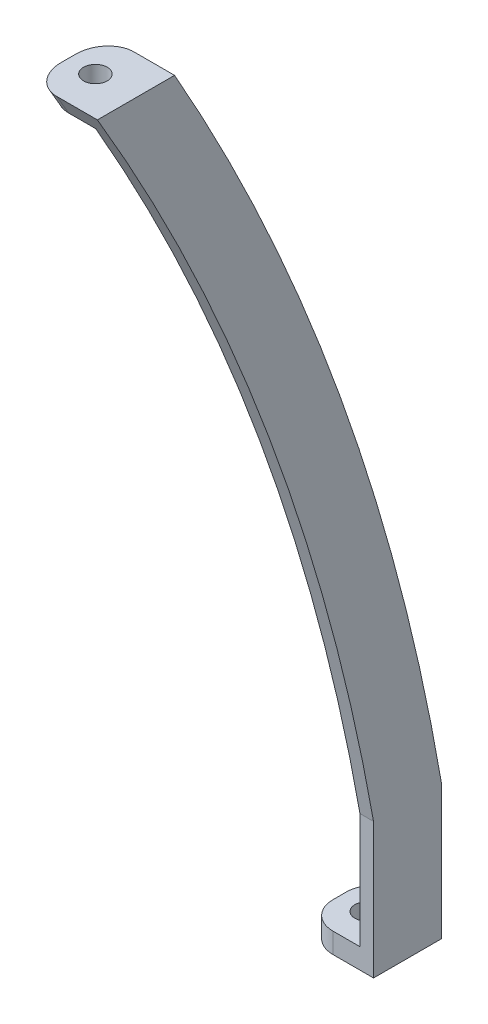
from build123d import *

# Parameters (mm, degrees)
BOSS_EXTRUDE1_DEPTH     = 2
BOSS_EXTRUDE2_START     = -8
SKETCH2_W               = 10
SKETCH2_H               = 3
BOSS_EXTRUDE2_DEPTH     = 8
FILLET1_R               = 4
CUT_EXTRUDE1_DEPTH      = 134.613209202
CUT_EXTRUDE1_DEPTH_BACK = 134.613209202
SKETCH3_R               = 1.75


with BuildPart() as part:
    # Sketch1 → Boss-Extrude1 (new body)
    with BuildSketch(Plane(origin=(0, 0, 0), x_dir=(0, 0, -1), z_dir=(1, 0, 0))):
        with BuildLine():
            Line((-40.736833925, 130), (-29.353634228, 130))
            ThreePointArc((-29.353634228, 130), (-4.909489029, 76.705560779), (10, 20))
            Line((10, 20), (10, 0))
            Line((10, 0), (0, 0))
            Line((0, 0), (0, 20))
            ThreePointArc((0, 20), (-15.436156632, 76.826587909), (-40.736833925, 130))
        make_face()
    extrude(amount=BOSS_EXTRUDE1_DEPTH)

    # Sketch2 → Boss-Extrude2 (add)
    with BuildSketch(Plane(origin=(0, 0, 0), x_dir=(0, 0, -1), z_dir=(1, 0, 0)).offset(BOSS_EXTRUDE2_START)):
        with Locations((5, 1.5)):
            Rectangle(SKETCH2_W, SKETCH2_H)
        with BuildLine():
            Line((-40.736833925, 130), (-29.353634228, 130))
            ThreePointArc((-29.353634228, 130), (-28.507977965, 128.502132743), (-27.669921848, 127))
            Line((-27.669921848, 127), (-38.985998837, 127))
            ThreePointArc((-38.985998837, 127), (-39.857464817, 128.502306179), (-40.736833925, 130))
        make_face()
    extrude(amount=BOSS_EXTRUDE2_DEPTH)

    # Fillet1
    fillet1_edges = [part.edges().sort_by_distance(p)[0] for p in [
        (-8, 1.5, 0),
        (-8, 1.5, -10),
        (-8, 128.502306179, 39.857464817),
        (-8, 128.502132743, 28.507977965),
    ]]
    fillet(fillet1_edges, radius=FILLET1_R)

    # Sketch3 → Cut-Extrude1 (cut, two sides: drawn at the far end of the back side and taken through both)
    with BuildSketch(Plane(origin=(0, 3, 0), x_dir=(1, 0, 0), z_dir=(0, 1, 0)).offset(-CUT_EXTRUDE1_DEPTH_BACK)):
        with Locations(Location((-4, 5, 0), (0, 0, 270))):
            Circle(SKETCH3_R)
        with Locations(Location((-4, -35.031677414, 0), (0, 0, 270))):
            Circle(SKETCH3_R)
    extrude(amount=CUT_EXTRUDE1_DEPTH + CUT_EXTRUDE1_DEPTH_BACK, mode=Mode.SUBTRACT)


solid = part.part
